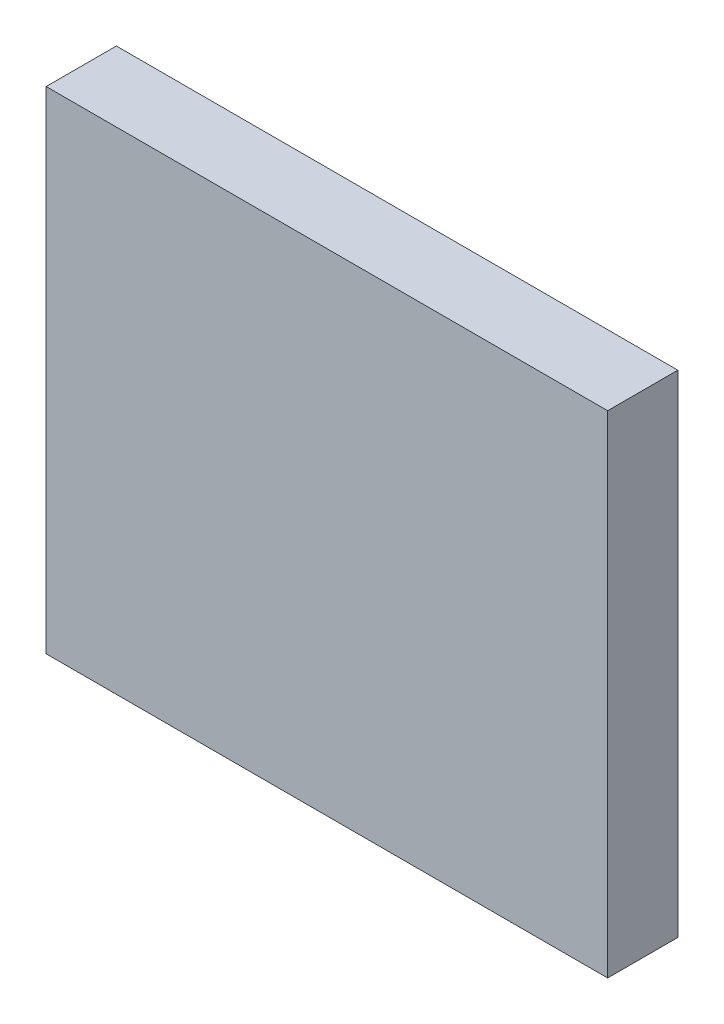
from build123d import *

# Parameters (mm, degrees)
ESQUISSE1_W        = 80
ESQUISSE1_H        = 70
BOSS_EXTRU_1_DEPTH = 10


with BuildPart() as part:
    # Esquisse1 → Boss.-Extru.1 (new body)
    with BuildSketch(Plane.XY):
        Rectangle(ESQUISSE1_W, ESQUISSE1_H)
    extrude(amount=BOSS_EXTRU_1_DEPTH)


solid = part.part
